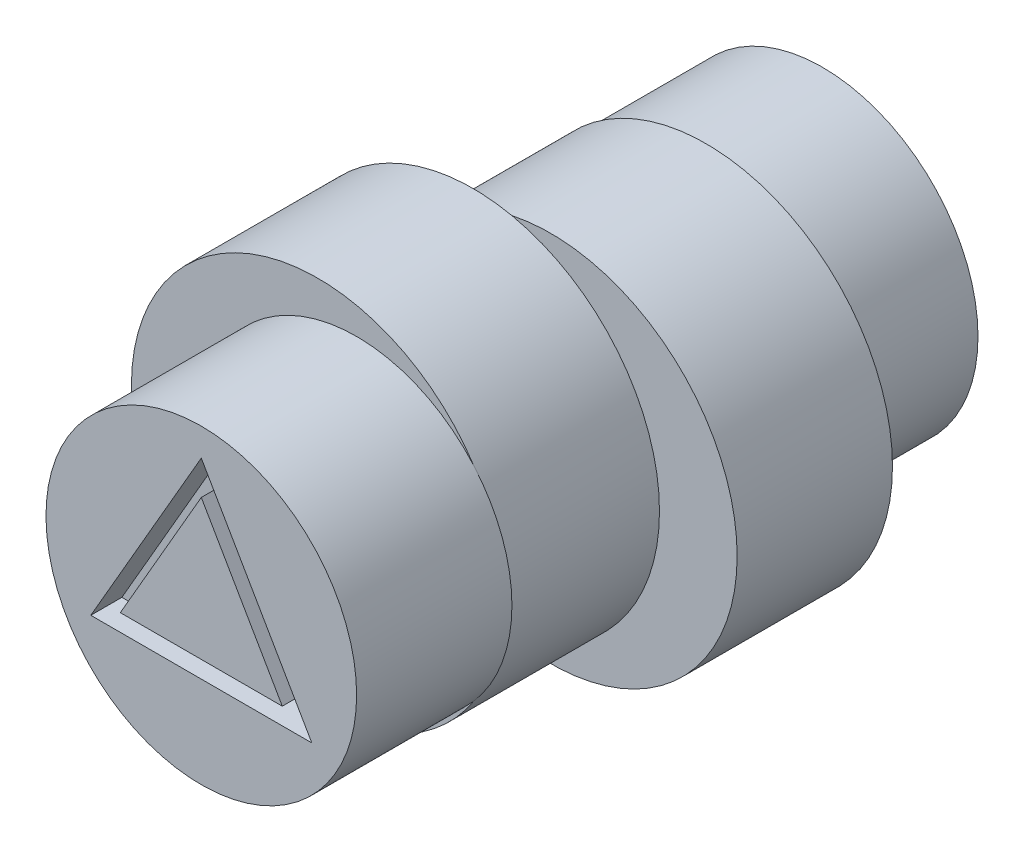
from build123d import *

# Parameters (mm, degrees)
SKETCH2_R           = 5.0038
BOSS_EXTRUDE1_DEPTH = 5
SKETCH3_R           = 6
BOSS_EXTRUDE2_DEPTH = 5
SKETCH5_R           = 6
BOSS_EXTRUDE3_DEPTH = 5
SKETCH6_R           = 5
BOSS_EXTRUDE4_DEPTH = 5
SKETCH8_R           = 2.698107805
BOSS_EXTRUDE5_DEPTH = 4.6
CUT_EXTRUDE1_DEPTH  = 1


with BuildPart() as part:
    # Sketch2 → Boss-Extrude1 (new body)
    with BuildSketch(Plane.XY.offset(-1161.582265199)):
        Circle(SKETCH2_R)
        with BuildLine():
            Line((2, 1.5), (2, -1.5))
            ThreePointArc((2, -1.5), (-2.5, 0), (2, 1.5))
        make_face(mode=Mode.SUBTRACT)
    extrude(amount=BOSS_EXTRUDE1_DEPTH)

    # Sketch3 → Boss-Extrude2 (add)
    with BuildSketch(Plane.XY.offset(-1156.582265199)):
        with Locations(Location((1.25, 0, 0), (0, 0, 213.387732771))):
            Circle(SKETCH3_R)
        with BuildLine():
            Line((2, 1.5), (2, -1.5))
            ThreePointArc((2, -1.5), (-2.5, 0), (2, 1.5))
        make_face(mode=Mode.SUBTRACT)
    extrude(amount=BOSS_EXTRUDE2_DEPTH)

    # Sketch5 → Boss-Extrude3 (add)
    with BuildSketch(Plane.XY.offset(-1151.582265199)):
        with Locations(Location((-1.25, 0, 0), (0, 0, 282.024699181))):
            Circle(SKETCH5_R)
        with BuildLine():
            Line((2, 1.5), (2, -1.5))
            ThreePointArc((2, -1.5), (-2.5, 0), (2, 1.5))
        make_face(mode=Mode.SUBTRACT)
    extrude(amount=BOSS_EXTRUDE3_DEPTH)

    # Sketch6 → Boss-Extrude4 (add)
    with BuildSketch(Plane.XY.offset(-1146.582265199)):
        with Locations(Location((0, 0, 0), (0, 0, 319.025369771))):
            Circle(SKETCH6_R)
        with BuildLine():
            Line((2, 1.5), (2, -1.5))
            ThreePointArc((2, -1.5), (-2.5, 0), (2, 1.5))
        make_face(mode=Mode.SUBTRACT)
    extrude(amount=BOSS_EXTRUDE4_DEPTH)

    # Sketch8 → Boss-Extrude5 (add)
    with BuildSketch(Plane.XY.offset(-1146.182265199)):
        Circle(SKETCH8_R)
    extrude(amount=BOSS_EXTRUDE5_DEPTH)

    # Sketch9 → Cut-Extrude1 (cut)
    with BuildSketch(Plane.XY.offset(-1141.582265199)):
        Polygon((0, 4.107590662), (-3.557277862, -2.053795331), (3.557277862, -2.053795331), align=None)
        Polygon((0, 3.010552133), (-2.607214626, -1.505276066), (2.607214626, -1.505276066), align=None, mode=Mode.SUBTRACT)
    extrude(amount=-CUT_EXTRUDE1_DEPTH, mode=Mode.SUBTRACT)


solid = part.part
